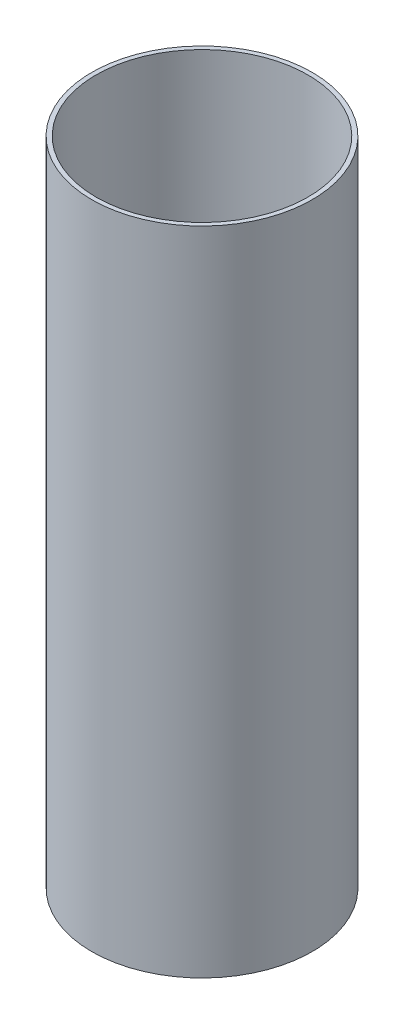
from build123d import *

# Parameters (mm, degrees)
SKETCH1_R           = 25.4
SKETCH1_R_2         = 24.4
BOSS_EXTRUDE1_DEPTH = 150


with BuildPart() as part:
    # Sketch1 → Boss-Extrude1 (new body)
    with BuildSketch(Plane(origin=(0, 0, 0), x_dir=(1, 0, 0), z_dir=(0, 1, 0))):
        with Locations(Location((0, 0, 0), (0, 0, 270))):
            Circle(SKETCH1_R)
        with Locations(Location((0, 0, 0), (0, 0, 270))):
            Circle(SKETCH1_R_2, mode=Mode.SUBTRACT)
    extrude(amount=BOSS_EXTRUDE1_DEPTH)


solid = part.part
